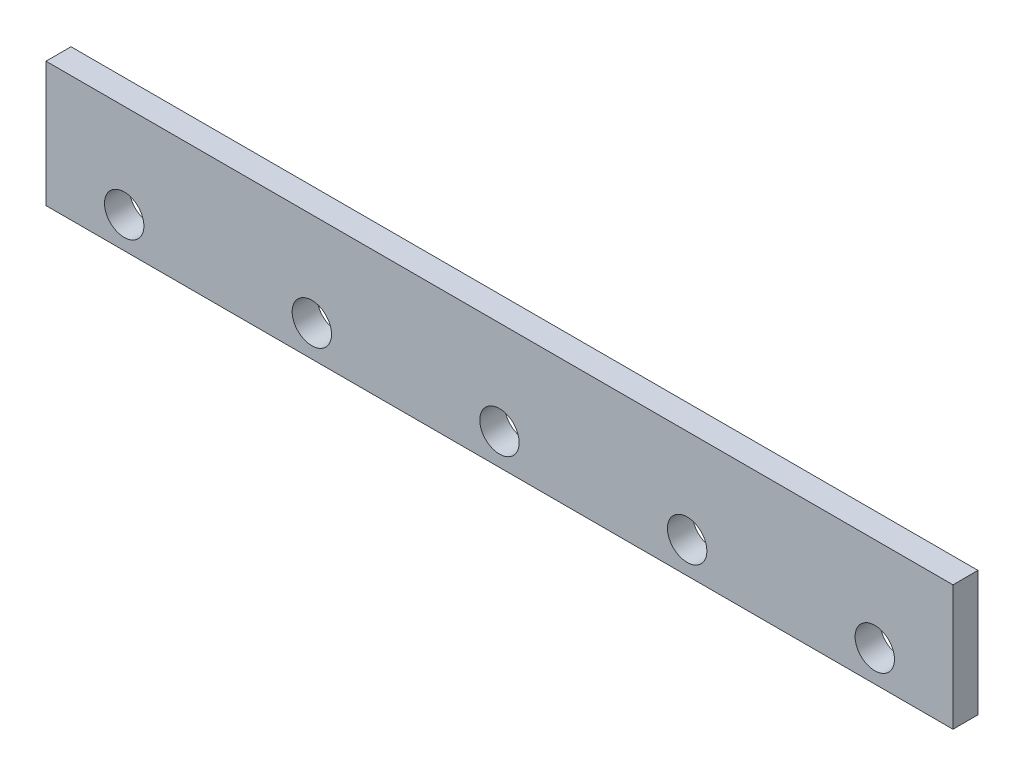
from build123d import *

# Parameters (mm, degrees)
CROQUIS1_W              = 580
CROQUIS1_H              = 80
CROQUIS1_R              = 12.6
SALIENTE_EXTRUIR1_DEPTH = 16


with BuildPart() as part:
    # Croquis1 → Saliente-Extruir1 (new body)
    with BuildSketch(Plane.XY):
        with Locations((290, 40)):
            Rectangle(CROQUIS1_W, CROQUIS1_H)
        with Locations((50, 20)):
            Circle(CROQUIS1_R, mode=Mode.SUBTRACT)
        with Locations((170, 20)):
            Circle(CROQUIS1_R, mode=Mode.SUBTRACT)
        with Locations((290, 20)):
            Circle(CROQUIS1_R, mode=Mode.SUBTRACT)
        with Locations((410, 20)):
            Circle(CROQUIS1_R, mode=Mode.SUBTRACT)
        with Locations((530, 20)):
            Circle(CROQUIS1_R, mode=Mode.SUBTRACT)
    extrude(amount=SALIENTE_EXTRUIR1_DEPTH)


solid = part.part
